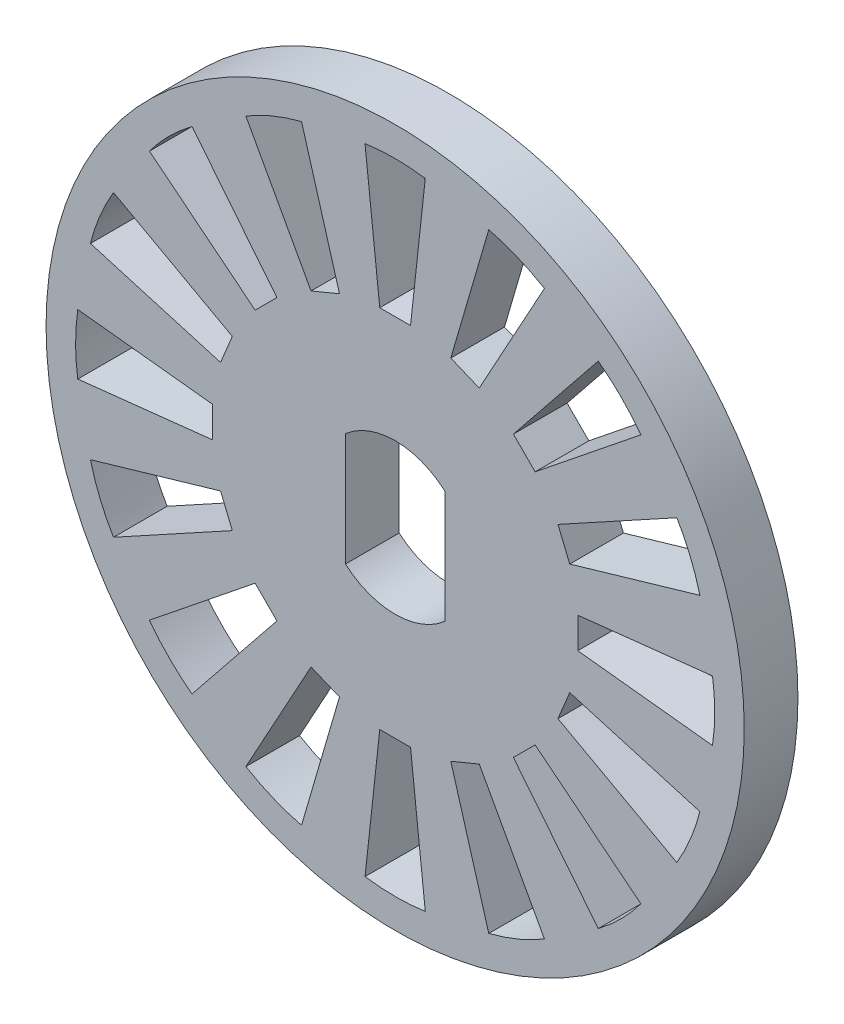
from build123d import *

# Parameters (mm, degrees)
SKETCH1_R           = 13
BOSS_EXTRUDE1_DEPTH = 2
CUT_EXTRUDE1_DEPTH  = 2
CUT_EXTRUDE2_DEPTH  = 2


with BuildPart() as part:
    # Sketch1 → Boss-Extrude1 (new body)
    with BuildSketch(Plane.XY):
        Circle(SKETCH1_R)
    extrude(amount=BOSS_EXTRUDE1_DEPTH)

    # Sketch2 → Cut-Extrude1 (cut)
    with BuildSketch(Plane.XY.offset(2)):
        with BuildLine():
            Line((1.85, 2.101784956), (1.85, -2.101784956))
            ThreePointArc((1.85, -2.101784956), (0, -2.8), (-1.85, -2.101784956))
            Line((-1.85, -2.101784956), (-1.85, 2.101784956))
            ThreePointArc((-1.85, 2.101784956), (0, 2.8), (1.85, 2.101784956))
        make_face()
    extrude(amount=-CUT_EXTRUDE1_DEPTH, mode=Mode.SUBTRACT)

    # Sketch3 → Cut-Extrude2 (cut)
    with BuildSketch(Plane.XY.offset(2)):
        with BuildLine():
            Line((-0.57328151, 6.8), (0.57328151, 6.8))
            Line((0.57328151, 6.8), (1.12176411, 11.818471303))
            add(Edge.make_bspline(
                [(-1.12176411, 11.818471303), (0, 11.981579841), (1.12176411, 11.818471303)],
                knots=[0, 0, 0, 1, 1, 1], degree=2))
            Line((-1.12176411, 11.818471303), (-0.57328151, 6.8))
        make_face()
        with BuildLine():
            Line((3.131890393, 6.062995485), (5.559108065, 10.489563203))
            add(Edge.make_bspline(
                [(3.486358262, 11.348124283), (4.585152099, 11.069536382), (5.559108065, 10.489563203)],
                knots=[0, 0, 0, 1, 1, 1], degree=2))
            Line((3.486358262, 11.348124283), (2.072604287, 6.501766157))
            Line((2.072604287, 6.501766157), (3.131890393, 6.062995485))
        make_face()
        with BuildLine():
            Line((5.213697355, 4.402954869), (9.150128211, 7.563714193))
            add(Edge.make_bspline(
                [(7.563714193, 9.150128211), (8.472256355, 8.472256355), (9.150128211, 7.563714193)],
                knots=[0, 0, 0, 1, 1, 1], degree=2))
            Line((7.563714193, 9.150128211), (4.402954869, 5.213697355))
            Line((4.402954869, 5.213697355), (5.213697355, 4.402954869))
        make_face()
        with BuildLine():
            Line((6.501766157, 2.072604287), (11.348124283, 3.486358262))
            add(Edge.make_bspline(
                [(10.489563203, 5.559108065), (11.069536382, 4.585152099), (11.348124283, 3.486358262)],
                knots=[0, 0, 0, 1, 1, 1], degree=2))
            Line((10.489563203, 5.559108065), (6.062995485, 3.131890393))
            Line((6.062995485, 3.131890393), (6.501766157, 2.072604287))
        make_face()
        with BuildLine():
            Line((6.8, -0.57328151), (11.818471303, -1.12176411))
            add(Edge.make_bspline(
                [(11.818471303, 1.12176411), (11.981579841, 0), (11.818471303, -1.12176411)],
                knots=[0, 0, 0, 1, 1, 1], degree=2))
            Line((11.818471303, 1.12176411), (6.8, 0.57328151))
            Line((6.8, 0.57328151), (6.8, -0.57328151))
        make_face()
        with BuildLine():
            Line((6.062995485, -3.131890393), (10.489563203, -5.559108065))
            add(Edge.make_bspline(
                [(11.348124283, -3.486358262), (11.069536382, -4.585152099), (10.489563203, -5.559108065)],
                knots=[0, 0, 0, 1, 1, 1], degree=2))
            Line((11.348124283, -3.486358262), (6.501766157, -2.072604287))
            Line((6.501766157, -2.072604287), (6.062995485, -3.131890393))
        make_face()
        with BuildLine():
            Line((4.402954869, -5.213697355), (7.563714193, -9.150128211))
            add(Edge.make_bspline(
                [(9.150128211, -7.563714193), (8.472256355, -8.472256355), (7.563714193, -9.150128211)],
                knots=[0, 0, 0, 1, 1, 1], degree=2))
            Line((9.150128211, -7.563714193), (5.213697355, -4.402954869))
            Line((5.213697355, -4.402954869), (4.402954869, -5.213697355))
        make_face()
        with BuildLine():
            Line((2.072604287, -6.501766157), (3.486358262, -11.348124283))
            add(Edge.make_bspline(
                [(5.559108065, -10.489563203), (4.585152099, -11.069536382), (3.486358262, -11.348124283)],
                knots=[0, 0, 0, 1, 1, 1], degree=2))
            Line((5.559108065, -10.489563203), (3.131890393, -6.062995485))
            Line((3.131890393, -6.062995485), (2.072604287, -6.501766157))
        make_face()
        with BuildLine():
            Line((-0.57328151, -6.8), (-1.12176411, -11.818471303))
            add(Edge.make_bspline(
                [(1.12176411, -11.818471303), (0, -11.981579841), (-1.12176411, -11.818471303)],
                knots=[0, 0, 0, 1, 1, 1], degree=2))
            Line((1.12176411, -11.818471303), (0.57328151, -6.8))
            Line((0.57328151, -6.8), (-0.57328151, -6.8))
        make_face()
        with BuildLine():
            Line((-3.131890393, -6.062995485), (-5.559108065, -10.489563203))
            add(Edge.make_bspline(
                [(-3.486358262, -11.348124283), (-4.585152099, -11.069536382), (-5.559108065, -10.489563203)],
                knots=[0, 0, 0, 1, 1, 1], degree=2))
            Line((-3.486358262, -11.348124283), (-2.072604287, -6.501766157))
            Line((-2.072604287, -6.501766157), (-3.131890393, -6.062995485))
        make_face()
        with BuildLine():
            Line((-5.213697355, -4.402954869), (-9.150128211, -7.563714193))
            add(Edge.make_bspline(
                [(-7.563714193, -9.150128211), (-8.472256355, -8.472256355), (-9.150128211, -7.563714193)],
                knots=[0, 0, 0, 1, 1, 1], degree=2))
            Line((-7.563714193, -9.150128211), (-4.402954869, -5.213697355))
            Line((-4.402954869, -5.213697355), (-5.213697355, -4.402954869))
        make_face()
        with BuildLine():
            Line((-6.501766157, -2.072604287), (-11.348124283, -3.486358262))
            add(Edge.make_bspline(
                [(-10.489563203, -5.559108065), (-11.069536382, -4.585152099), (-11.348124283, -3.486358262)],
                knots=[0, 0, 0, 1, 1, 1], degree=2))
            Line((-10.489563203, -5.559108065), (-6.062995485, -3.131890393))
            Line((-6.062995485, -3.131890393), (-6.501766157, -2.072604287))
        make_face()
        with BuildLine():
            Line((-6.8, 0.57328151), (-11.818471303, 1.12176411))
            add(Edge.make_bspline(
                [(-11.818471303, -1.12176411), (-11.981579841, 0), (-11.818471303, 1.12176411)],
                knots=[0, 0, 0, 1, 1, 1], degree=2))
            Line((-11.818471303, -1.12176411), (-6.8, -0.57328151))
            Line((-6.8, -0.57328151), (-6.8, 0.57328151))
        make_face()
        with BuildLine():
            Line((-6.062995485, 3.131890393), (-10.489563203, 5.559108065))
            add(Edge.make_bspline(
                [(-11.348124283, 3.486358262), (-11.069536382, 4.585152099), (-10.489563203, 5.559108065)],
                knots=[0, 0, 0, 1, 1, 1], degree=2))
            Line((-11.348124283, 3.486358262), (-6.501766157, 2.072604287))
            Line((-6.501766157, 2.072604287), (-6.062995485, 3.131890393))
        make_face()
        with BuildLine():
            Line((-4.402954869, 5.213697355), (-7.563714193, 9.150128211))
            add(Edge.make_bspline(
                [(-9.150128211, 7.563714193), (-8.472256355, 8.472256355), (-7.563714193, 9.150128211)],
                knots=[0, 0, 0, 1, 1, 1], degree=2))
            Line((-9.150128211, 7.563714193), (-5.213697355, 4.402954869))
            Line((-5.213697355, 4.402954869), (-4.402954869, 5.213697355))
        make_face()
        with BuildLine():
            Line((-2.072604287, 6.501766157), (-3.486358262, 11.348124283))
            add(Edge.make_bspline(
                [(-5.559108065, 10.489563203), (-4.585152099, 11.069536382), (-3.486358262, 11.348124283)],
                knots=[0, 0, 0, 1, 1, 1], degree=2))
            Line((-5.559108065, 10.489563203), (-3.131890393, 6.062995485))
            Line((-3.131890393, 6.062995485), (-2.072604287, 6.501766157))
        make_face()
    extrude(amount=-CUT_EXTRUDE2_DEPTH, mode=Mode.SUBTRACT)


solid = part.part
